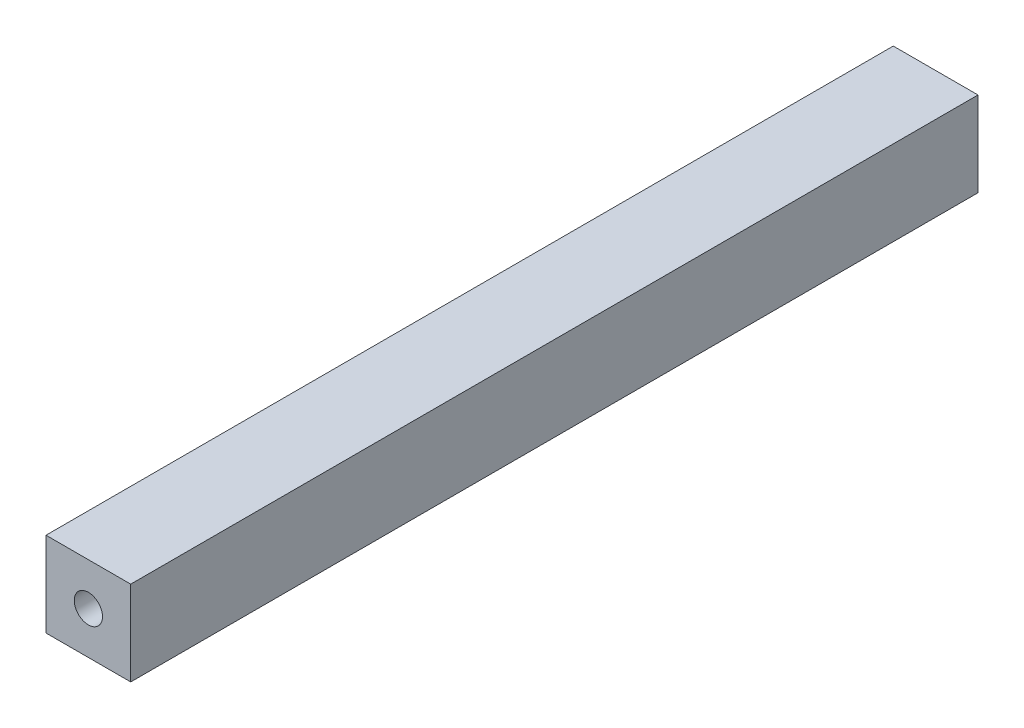
from build123d import *

# Parameters (mm, degrees)
SKETCH1_W           = 9
SKETCH1_H           = 9
SKETCH1_W_2         = 3
SKETCH1_H_2         = 3
BOSS_EXTRUDE1_DEPTH = 90


with BuildPart() as part:
    # Sketch1 → Boss-Extrude1 (new body)
    # profile 1 of 5: a face of its own
    with BuildSketch(Plane.XY):
        Rectangle(SKETCH1_W, SKETCH1_H)
        Rectangle(SKETCH1_W_2, SKETCH1_H_2, mode=Mode.SUBTRACT)
    # profile 2 of 5: a face of its own
    with BuildSketch(Plane.XY):
        with BuildLine():
            Line((-1.5, 1.5), (-1.5, 0))
            ThreePointArc((-1.5, 0), (-1.060660172, 1.060660172), (0, 1.5))
            Line((0, 1.5), (-1.5, 1.5))
        make_face()
    # profile 3 of 5: a face of its own
    with BuildSketch(Plane.XY):
        with BuildLine():
            ThreePointArc((0, 1.5), (1.060660172, 1.060660172), (1.5, 0))
            Line((1.5, 0), (1.5, 1.5))
            Line((1.5, 1.5), (0, 1.5))
        make_face()
    # profile 4 of 5: a face of its own
    with BuildSketch(Plane.XY):
        with BuildLine():
            ThreePointArc((1.5, 0), (1.060660172, -1.060660172), (0, -1.5))
            Line((0, -1.5), (1.5, -1.5))
            Line((1.5, -1.5), (1.5, 0))
        make_face()
    # profile 5 of 5: a face of its own
    with BuildSketch(Plane.XY):
        with BuildLine():
            Line((-1.5, 0), (-1.5, -1.5))
            Line((-1.5, -1.5), (0, -1.5))
            ThreePointArc((0, -1.5), (-1.060660172, -1.060660172), (-1.5, 0))
        make_face()
    extrude(amount=BOSS_EXTRUDE1_DEPTH)


solid = part.part
